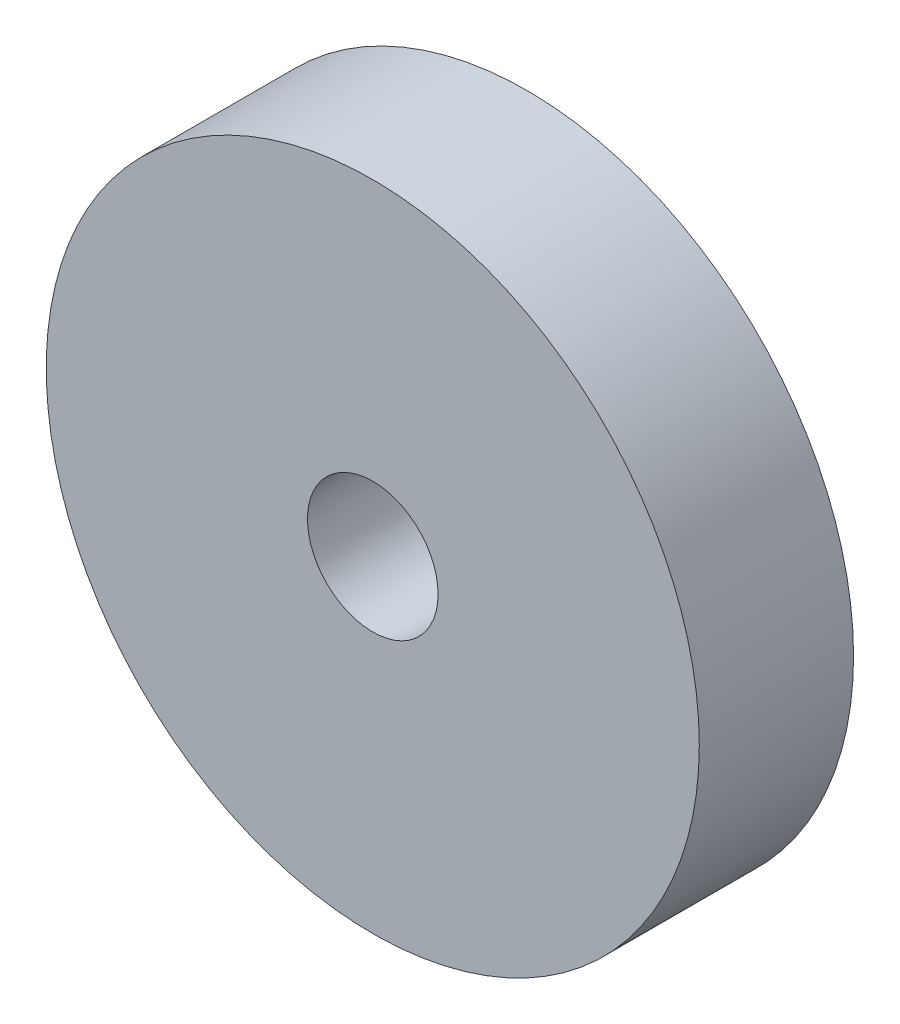
from build123d import *

# Parameters (mm, degrees)
CROQUIS1_R              = 63.5
CROQUIS1_R_2            = 12.7
SALIENTE_EXTRUIR1_DEPTH = 30


with BuildPart() as part:
    # Croquis1 → Saliente-Extruir1 (new body)
    with BuildSketch(Plane.XY):
        Circle(CROQUIS1_R)
        Circle(CROQUIS1_R_2, mode=Mode.SUBTRACT)
    extrude(amount=SALIENTE_EXTRUIR1_DEPTH)


solid = part.part
